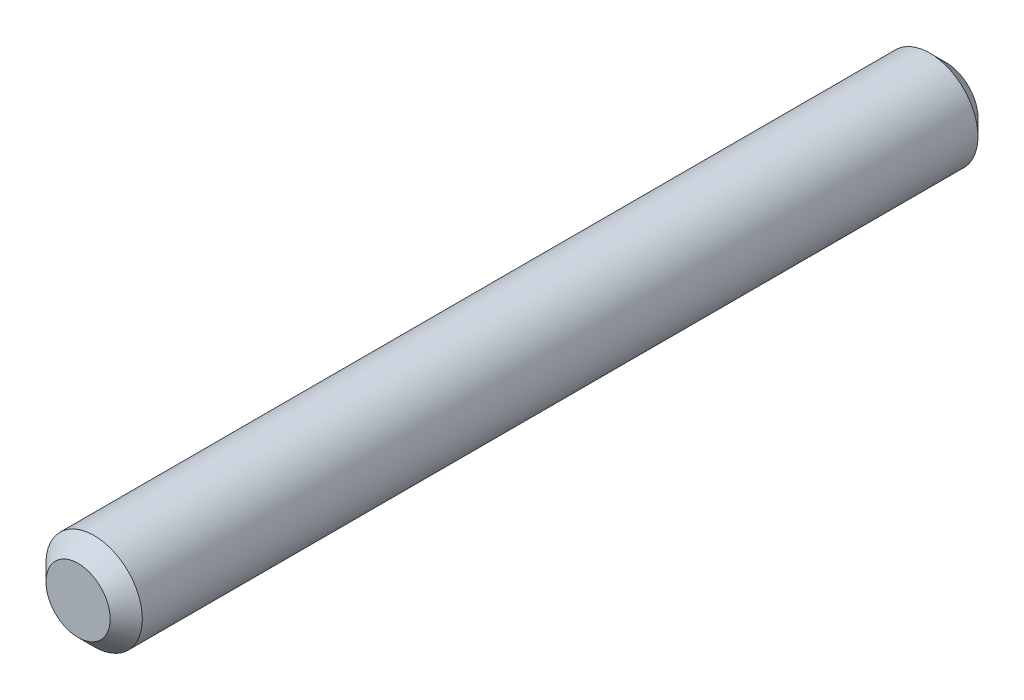
from build123d import *

# Parameters (mm, degrees)
SCHIZZO1_R                   = 3
ESTRUSIONE_ESTRUSIONE1_DEPTH = 54
SMUSSO1_SIZE                 = 1


with BuildPart() as part:
    # Schizzo1 → Estrusione-Estrusione1 (new body)
    with BuildSketch(Plane.XY):
        Circle(SCHIZZO1_R)
    extrude(amount=ESTRUSIONE_ESTRUSIONE1_DEPTH)

    # Smusso1
    smusso1_edges = [part.edges().sort_by_distance(p)[0] for p in [
        (-3, 0, 0),
        (-3, 0, 54),
    ]]
    chamfer(smusso1_edges, length=SMUSSO1_SIZE)


solid = part.part
